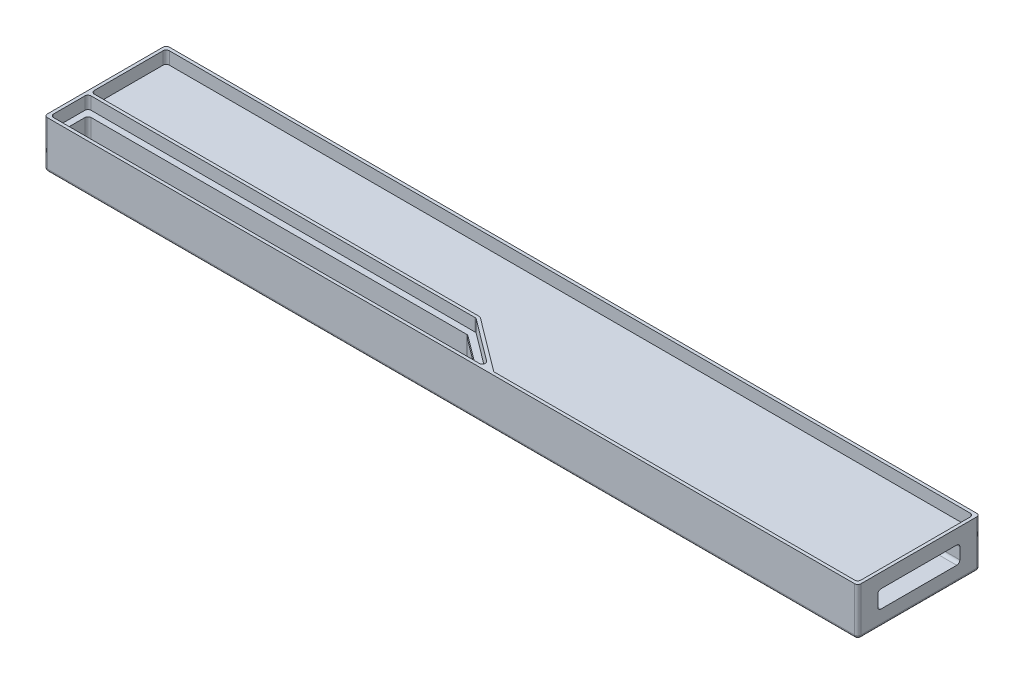
from build123d import *

# Parameters (mm, degrees)
EXTRUDE_1_DEPTH     = 7.6
CUT_EXTRUDE_1_DEPTH = 2
CUT_EXTRUDE_2_DEPTH = 66.965312855
CUT_EXTRUDE_START   = -1.6
CUT_EXTRUDE_3_DEPTH = 1.6
CUT_EXTRUDE_START_2 = -3.3
CUT_EXTRUDE_4_DEPTH = 3.3
CUT_EXTRUDE_5_DEPTH = 10
FILLET_1_R          = 0.5


with BuildPart() as part:
    # Эскиз1 → Бобышка-Вытянуть1 (new body)
    with BuildSketch(Plane(origin=(0, 0, 0), x_dir=(1, 0, 0), z_dir=(0, 1, 0))):
        with BuildLine():
            Line((-64.5, 9.75), (64.5, 9.75))
            ThreePointArc((64.5, 9.75), (64.853553391, 9.603553391), (65, 9.25))
            Line((65, 9.25), (65, -9.25))
            ThreePointArc((65, -9.25), (64.853553391, -9.603553391), (64.5, -9.75))
            Line((64.5, -9.75), (-64.5, -9.75))
            ThreePointArc((-64.5, -9.75), (-64.853553391, -9.603553391), (-65, -9.25))
            Line((-65, -9.25), (-65, 9.25))
            ThreePointArc((-65, 9.25), (-64.853553391, 9.603553391), (-64.5, 9.75))
        make_face()
    extrude(amount=EXTRUDE_1_DEPTH)

    # Эскиз2 → Вырез-Вытянуть1 (cut)
    with BuildSketch(Plane(origin=(0, 7.6, 0), x_dir=(1, 0, 0), z_dir=(0, 1, 0))):
        with BuildLine():
            Line((-64, -3.25), (-2.666666667, -3.25))
            ThreePointArc((-2.666666667, -3.25), (-2.508552784, -3.275658351), (-2.366666667, -3.35))
            Line((-2.366666667, -3.35), (4.3, -8.35))
            ThreePointArc((4.3, -8.35), (4.474341649, -8.908113883), (4, -9.25))
            Line((4, -9.25), (-64, -9.25))
            ThreePointArc((-64, -9.25), (-64.353553391, -9.103553391), (-64.5, -8.75))
            Line((-64.5, -8.75), (-64.5, -3.75))
            ThreePointArc((-64.5, -3.75), (-64.353553391, -3.396446609), (-64, -3.25))
        make_face()
        with BuildLine():
            Line((-64, 9.25), (64, 9.25))
            ThreePointArc((64, 9.25), (64.353553391, 9.103553391), (64.5, 8.75))
            Line((64.5, 8.75), (64.5, -8.75))
            ThreePointArc((64.5, -8.75), (64.353553391, -9.103553391), (64, -9.25))
            Line((64, -9.25), (6.5, -9.25))
            ThreePointArc((6.5, -9.25), (6.341886117, -9.224341649), (6.2, -9.15))
            Line((6.2, -9.15), (-2.2, -2.85))
            ThreePointArc((-2.2, -2.85), (-2.341886117, -2.775658351), (-2.5, -2.75))
            Line((-2.5, -2.75), (-64, -2.75))
            ThreePointArc((-64, -2.75), (-64.353553391, -2.603553391), (-64.5, -2.25))
            Line((-64.5, -2.25), (-64.5, 8.75))
            ThreePointArc((-64.5, 8.75), (-64.353553391, 9.103553391), (-64, 9.25))
        make_face()
    extrude(amount=-CUT_EXTRUDE_1_DEPTH, mode=Mode.SUBTRACT)

    # Эскиз6 → Вырез-Вытянуть2 (cut, through all)
    with BuildSketch(Plane(origin=(0, 5.6, 0), x_dir=(1, 0, 0), z_dir=(0, 1, 0))):
        with BuildLine():
            Line((-63, -8.25), (1.020582083, -8.25))
            ThreePointArc((1.020582083, -8.25), (1.494923732, -7.908113883), (1.320582083, -7.35))
            Line((1.320582083, -7.35), (-2.695152274, -4.338199232))
            ThreePointArc((-2.695152274, -4.338199232), (-2.837038391, -4.263857583), (-2.995152274, -4.238199232))
            Line((-2.995152274, -4.238199232), (-63, -4.238199232))
            ThreePointArc((-63, -4.238199232), (-63.353553391, -4.384645841), (-63.5, -4.738199232))
            Line((-63.5, -4.738199232), (-63.5, -7.75))
            ThreePointArc((-63.5, -7.75), (-63.353553391, -8.103553391), (-63, -8.25))
        make_face()
    extrude(amount=-CUT_EXTRUDE_2_DEPTH, mode=Mode.SUBTRACT)

    # Эскиз7 → Вырез-Вытянуть3 (cut)
    with BuildSketch(Plane.XZ.offset(CUT_EXTRUDE_START)):
        with BuildLine():
            Line((-63, 4.25), (59.5, 4.25))
            ThreePointArc((59.5, 4.25), (59.853553391, 4.396446609), (60, 4.75))
            Line((60, 4.75), (60, 7.75))
            ThreePointArc((60, 7.75), (59.853553391, 8.103553391), (59.5, 8.25))
            Line((59.5, 8.25), (-63, 8.25))
            ThreePointArc((-63, 8.25), (-63.353553391, 8.103553391), (-63.5, 7.75))
            Line((-63.5, 7.75), (-63.5, 4.75))
            ThreePointArc((-63.5, 4.75), (-63.353553391, 4.396446609), (-63, 4.25))
        make_face()
        with BuildLine():
            Line((59.5, -7.75), (41, -7.75))
            ThreePointArc((41, -7.75), (40.646446609, -7.603553391), (40.5, -7.25))
            Line((40.5, -7.25), (40.5, 1.75))
            ThreePointArc((40.5, 1.75), (40.646446609, 2.103553391), (41, 2.25))
            Line((41, 2.25), (59.5, 2.25))
            ThreePointArc((59.5, 2.25), (59.853553391, 2.103553391), (60, 1.75))
            Line((60, 1.75), (60, -7.25))
            ThreePointArc((60, -7.25), (59.853553391, -7.603553391), (59.5, -7.75))
        make_face()
        with BuildLine():
            Line((-61.74, -8.15), (-61.76, -8.15))
            ThreePointArc((-61.76, -8.15), (-62.990365799, -7.640365799), (-63.5, -6.41))
            Line((-63.5, -6.41), (-63.5, 1.11))
            ThreePointArc((-63.5, 1.11), (-62.990365799, 2.340365799), (-61.76, 2.85))
            Line((-61.76, 2.85), (-61.74, 2.85))
            ThreePointArc((-61.74, 2.85), (-60.509634201, 2.340365799), (-60, 1.11))
            Line((-60, 1.11), (-60, -6.41))
            ThreePointArc((-60, -6.41), (-60.509634201, -7.640365799), (-61.74, -8.15))
        make_face()
    extrude(amount=CUT_EXTRUDE_3_DEPTH, mode=Mode.SUBTRACT)

    # Эскиз8 → Вырез-Вытянуть4 (cut)
    with BuildSketch(Plane.XZ.offset(-1.6).offset(CUT_EXTRUDE_START_2)):
        with BuildLine():
            Line((-63, 8.25), (40, 8.25))
            ThreePointArc((40, 8.25), (40.353553391, 8.103553391), (40.5, 7.75))
            Line((40.5, 7.75), (40.5, 4.75))
            ThreePointArc((40.5, 4.75), (40.353553391, 4.396446609), (40, 4.25))
            Line((40, 4.25), (-63, 4.25))
            ThreePointArc((-63, 4.25), (-63.353553391, 4.396446609), (-63.5, 4.75))
            Line((-63.5, 4.75), (-63.5, 7.75))
            ThreePointArc((-63.5, 7.75), (-63.353553391, 8.103553391), (-63, 8.25))
        make_face()
    extrude(amount=CUT_EXTRUDE_4_DEPTH, mode=Mode.SUBTRACT)

    # Эскиз9 → Вырез-Вытянуть5 (cut)
    with BuildSketch(Plane(origin=(65, 0, 0), x_dir=(0, 0, -1), z_dir=(1, 0, 0))):
        with BuildLine():
            Line((-6.05, 5.3), (6.05, 5.3))
            ThreePointArc((6.05, 5.3), (6.403553391, 5.153553391), (6.55, 4.8))
            Line((6.55, 4.8), (6.55, 3))
            ThreePointArc((6.55, 3), (6.403553391, 2.646446609), (6.05, 2.5))
            Line((6.05, 2.5), (-6.05, 2.5))
            ThreePointArc((-6.05, 2.5), (-6.403553391, 2.646446609), (-6.55, 3))
            Line((-6.55, 3), (-6.55, 4.8))
            ThreePointArc((-6.55, 4.8), (-6.403553391, 5.153553391), (-6.05, 5.3))
        make_face()
    extrude(amount=-CUT_EXTRUDE_5_DEPTH, mode=Mode.SUBTRACT)

    # Скругление1
    fillet_1_edges = [part.edges().sort_by_distance(p)[0] for p in [
        (0, 0, -9.75),
        (64.853553391, 0, -9.603553391),
        (65, 0, 0),
        (64.853553391, 0, 9.603553391),
        (0, 0, 9.75),
        (-64.853553391, 0, 9.603553391),
        (-65, 0, 0),
        (-64.853553391, 0, -9.603553391),
    ]]
    fillet(fillet_1_edges, radius=FILLET_1_R)


solid = part.part
